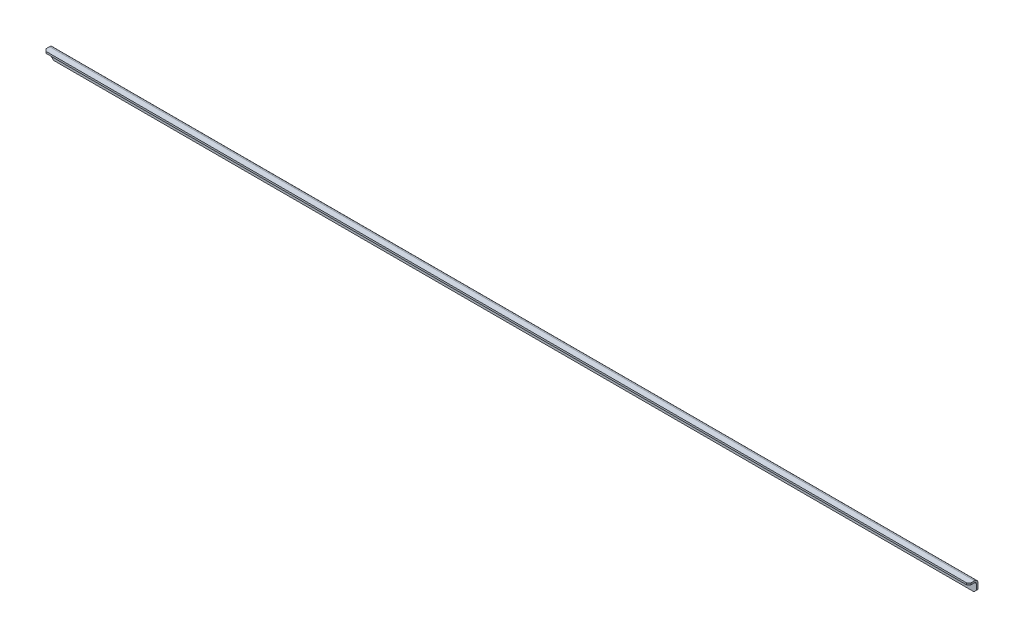
from build123d import *

# Parameters (mm, degrees)
BOSS_EXTRUDE1_DEPTH = 800
FILLET1_R           = 3
FILLET2_R           = 1.5
CHAMFER1_SIZE       = 2


with BuildPart() as part:
    # Sketch1 → Boss-Extrude1 (new body)
    with BuildSketch(Plane(origin=(0, 0, 0), x_dir=(0, 0, -1), z_dir=(1, 0, 0))):
        Polygon((0, 0), (0, 10), (-8, 10), (-8, 8.5), (-1.5, 8.5), (-1.5, 0), align=None)
    extrude(amount=BOSS_EXTRUDE1_DEPTH)

    # Fillet1
    fillet1_edges = [part.edges().sort_by_distance(p)[0] for p in [
        (400, 10, 0),
    ]]
    fillet(fillet1_edges, radius=FILLET1_R)

    # Fillet2
    fillet2_edges = [part.edges().sort_by_distance(p)[0] for p in [
        (400, 8.5, 1.5),
    ]]
    fillet(fillet2_edges, radius=FILLET2_R)

    # Chamfer1
    chamfer1_edges = [part.edges().sort_by_distance(p)[0] for p in [
        (800, 9.25, 8),
        (800, 0, 0.75),
        (0, 9.25, 8),
        (0, 0, 0.75),
    ]]
    chamfer(chamfer1_edges, length=CHAMFER1_SIZE)


solid = part.part
